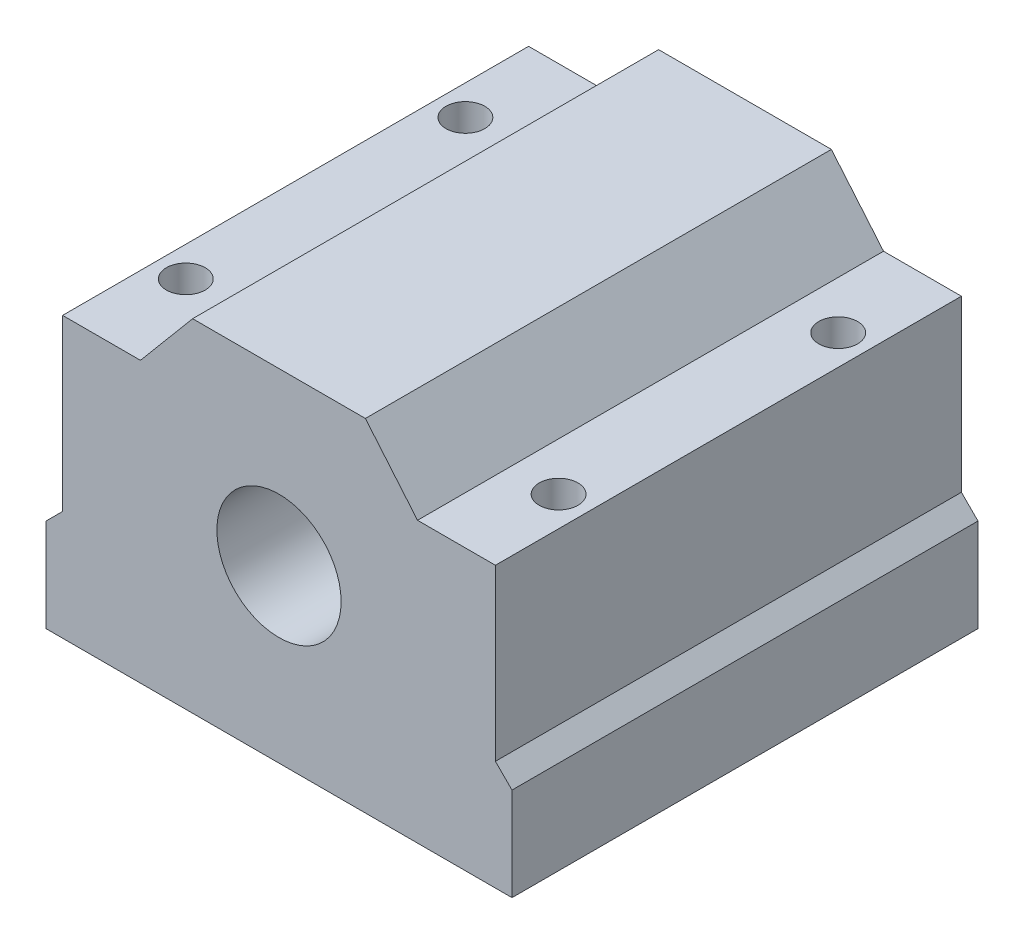
from build123d import *

# Parameters (mm, degrees)
SKETCH1_R             = 4
BOSS_EXTRUDE1_DEPTH   = 30
F_2_5MM_DOWEL_HOLE1_D = 2.5


with BuildPart() as part:
    # Sketch1 → Boss-Extrude1 (new body)
    with BuildSketch(Plane.XY):
        Polygon((-15, -11), (15, -11), (15, -5), (13.93169164, -3.93169164), (13.93169164, 7), (8.917679795, 7), (5.56128127, 11), (-5.56128127, 11), (-8.917679795, 7), (-13.93169164, 7), (-13.93169164, -3.93169164), (-15, -5), align=None)
        Circle(SKETCH1_R, mode=Mode.SUBTRACT)
    extrude(amount=-BOSS_EXTRUDE1_DEPTH)

    # Ø2.5mm Dowel Hole1 (through all)
    with Locations(Plane(origin=(0, 7, 0), x_dir=(1, 0, 0), z_dir=(0, 1, 0))):
        with Locations((-12, 24), (-12, 6), (12, 6), (12, 24)):
            Hole(F_2_5MM_DOWEL_HOLE1_D / 2)


solid = part.part
